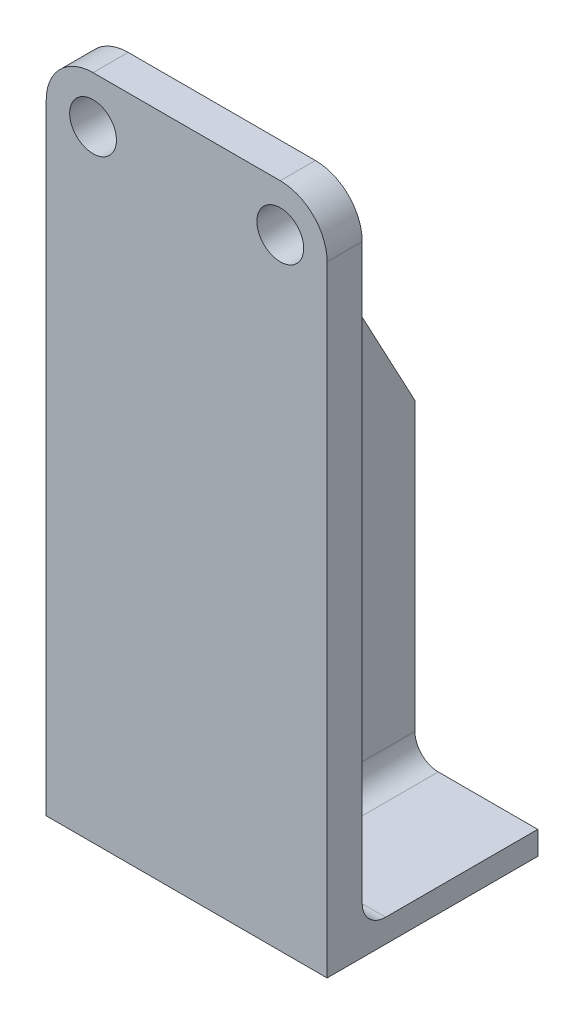
from build123d import *

# Parameters (mm, degrees)
SKETCH_1_R                    = 2
EXTRUDE_410_DEPTH             = 3
EXTRUDE_532_REACH             = 34.45
SKETCH_2_W                    = 15
SKETCH_2_H                    = 1.5
EXTRUDE_532_DIRECTION_2_REACH = 34.45
EXTRUDE_690_DEPTH             = 1.5
SKETCH_6_W                    = 10.5
SKETCH_6_H                    = 15
CUT_EXTRUDE_1_DEPTH           = 10
EXTRUDE_1_DEPTH               = 25
SKETCH_8_W                    = 10.5
SKETCH_8_H                    = 15
EXTRUDE_2_DEPTH               = 2
FILLET_1_R                    = 2


with BuildPart() as part:
    # Эскиз1 → Extrude 410 (new body)
    with BuildSketch(Plane.XY):
        with BuildLine():
            Line((-8, 30), (8, 30))
            ThreePointArc((8, 30), (10.828427125, 28.828427125), (12, 26))
            Line((12, 26), (12, 0))
            Line((12, 0), (-12, 0))
            Line((-12, 0), (-12, 26))
            ThreePointArc((-12, 26), (-10.828427125, 28.828427125), (-8, 30))
        make_face()
        with Locations((8, 26)):
            Circle(SKETCH_1_R, mode=Mode.SUBTRACT)
        with Locations(Location((-8, 26, 0), (0, 0, 180))):
            Circle(SKETCH_1_R, mode=Mode.SUBTRACT)
    extrude(amount=EXTRUDE_410_DEPTH)

    # Extrude 532: up to this face of the body (flat: up to its plane)
    extrude_532_end = Plane(part.part.faces().sort_by_distance((12, 13, 1.5))[0])
    # Эскиз2 → Extrude 532 (add, up to the picked face)
    with BuildSketch(Plane(origin=(0, 0, 0), x_dir=(0, 0, -1), z_dir=(1, 0, 0)), mode=Mode.PRIVATE) as extrude_532_sk1:
        with Locations((7.5, 0.75)):
            Rectangle(SKETCH_2_W, SKETCH_2_H)
    extrude_532_tool1 = split(extrude(extrude_532_sk1.sketch, amount=EXTRUDE_532_REACH, mode=Mode.PRIVATE), bisect_by=extrude_532_end, keep=Keep.BOTH, mode=Mode.PRIVATE)
    add(extrude_532_tool1.solids().sort_by(Axis((0, 0.75, -7.5), (1, 0, 0)))[0])

    # Extrude 532 direction 2: up to this face of the body (flat: up to its plane)
    extrude_532_direction_2_end = Plane(part.part.faces().sort_by_distance((-12, 13, 1.5))[0])
    # Эскиз2 → Extrude 532 direction 2 (add, up to the picked face)
    with BuildSketch(Plane(origin=(0, 0, 0), x_dir=(0, 0, -1), z_dir=(1, 0, 0)), mode=Mode.PRIVATE) as extrude_532_direction_2_sk1:
        with Locations((7.5, 0.75)):
            Rectangle(SKETCH_2_W, SKETCH_2_H)
    extrude_532_direction_2_tool1 = split(extrude(extrude_532_direction_2_sk1.sketch, amount=-EXTRUDE_532_DIRECTION_2_REACH, mode=Mode.PRIVATE), bisect_by=extrude_532_direction_2_end, keep=Keep.BOTH, mode=Mode.PRIVATE)
    add(extrude_532_direction_2_tool1.solids().sort_by(Axis((0, 0.75, -7.5), (-1, 0, 0)))[0])

    # Эскиз3 → Extrude 690 (add, symmetric)
    with BuildSketch(Plane(origin=(0, 0, 0), x_dir=(0, 0, -1), z_dir=(1, 0, 0))):
        Polygon((0, 1.5), (0, 29.5), (15, 1.5), align=None)
    extrude(amount=EXTRUDE_690_DEPTH, both=True)

    # Эскиз6 → Вырез-Вытянуть1 (cut)
    with BuildSketch(Plane(origin=(0, 1.5, 0), x_dir=(1, 0, 0), z_dir=(0, 1, 0))):
        with Locations((-6.75, 7.5)):
            Rectangle(SKETCH_6_W, SKETCH_6_H)
        with Locations((6.75, 7.5)):
            Rectangle(SKETCH_6_W, SKETCH_6_H)
    extrude(amount=-CUT_EXTRUDE_1_DEPTH, mode=Mode.SUBTRACT)

    # Эскиз7 → Бобышка-Вытянуть1 (add)
    with BuildSketch(Plane.XZ):
        Polygon((-12, 0), (-1.5, 0), (-1.5, -15), (1.5, -15), (1.5, 0), (12, 0), (12, 3), (-12, 3), align=None)
    extrude(amount=EXTRUDE_1_DEPTH)

    # Эскиз8 → Бобышка-Вытянуть2 (add)
    with BuildSketch(Plane.XZ.offset(25)):
        with Locations((-6.75, -7.5)):
            Rectangle(SKETCH_8_W, SKETCH_8_H)
        with Locations((6.75, -7.5)):
            Rectangle(SKETCH_8_W, SKETCH_8_H)
        Polygon((12, 3), (-12, 3), (-12, 0), (-1.5, 0), (-1.5, -15), (1.5, -15), (1.5, 0), (12, 0), align=None)
    extrude(amount=EXTRUDE_2_DEPTH)

    # Скругление1
    fillet_1_edges = [part.edges().sort_by_distance(p)[0] for p in [
        (-6.75, -25, 0),
        (-1.5, -25, -7.5),
        (1.5, -25, -7.5),
        (6.75, -25, 0),
    ]]
    fillet(fillet_1_edges, radius=FILLET_1_R)


solid = part.part
